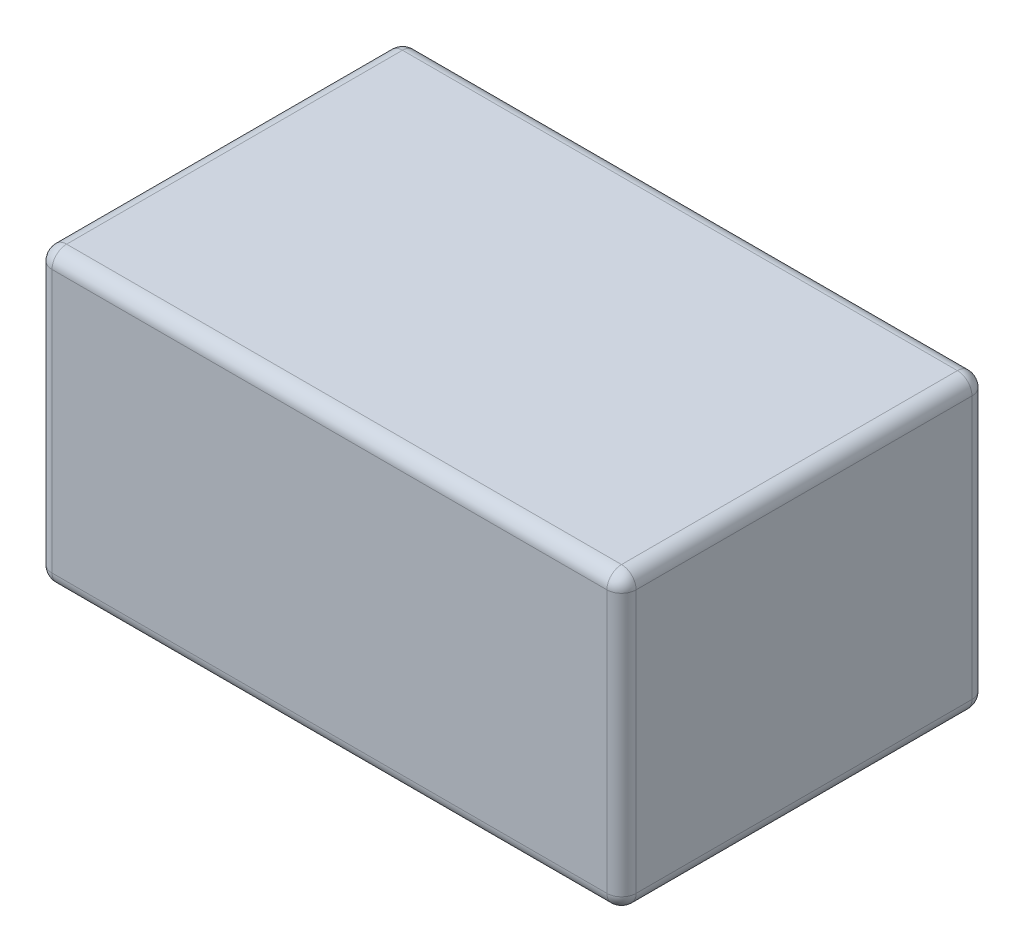
from build123d import *

# Parameters (mm, degrees)
SKETCH_1_W      = 80
SKETCH_1_H      = 50
EXTRUDE_1_DEPTH = 40
FILLET_1_R      = 2


with BuildPart() as part:
    # 草图1 → 凸台-拉伸1 (new body)
    with BuildSketch(Plane(origin=(0, 0, 0), x_dir=(1, 0, 0), z_dir=(0, 1, 0))):
        Rectangle(SKETCH_1_W, SKETCH_1_H)
    extrude(amount=EXTRUDE_1_DEPTH)

    # 圆角1
    fillet_1_edges = [part.edges().sort_by_distance(p)[0] for p in [
        (-40, 40, 0),
        (0, 40, 25),
        (40, 40, 0),
        (0, 0, 25),
        (-40, 0, 0),
        (0, 0, -25),
        (40, 0, 0),
        (0, 40, -25),
        (40, 20, 25),
        (-40, 20, 25),
        (-40, 20, -25),
        (40, 20, -25),
    ]]
    fillet(fillet_1_edges, radius=FILLET_1_R)


solid = part.part
